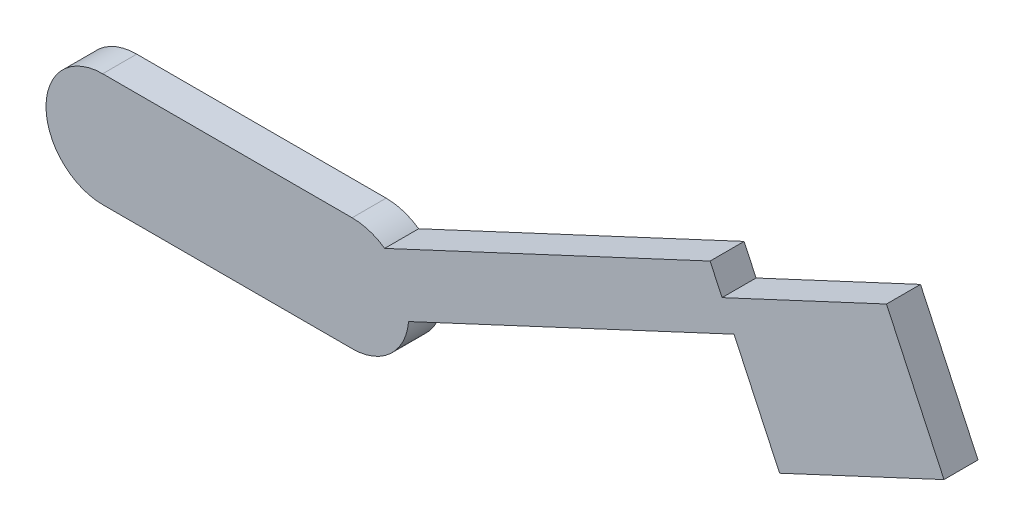
from build123d import *

# Parameters (mm, degrees)
SKETCH1_R           = 5
BOSS_EXTRUDE1_DEPTH = 3
SKETCH2_W           = 22
SKETCH2_H           = 10
BOSS_EXTRUDE2_DEPTH = 3
SKETCH3_R           = 5
BOSS_EXTRUDE3_DEPTH = 3
BOSS_EXTRUDE4_DEPTH = 3
BOSS_EXTRUDE5_DEPTH = 3


with BuildPart() as part:
    # Sketch1 → Boss-Extrude1 (new body)
    with BuildSketch(Plane.XY):
        Circle(SKETCH1_R)
    extrude(amount=BOSS_EXTRUDE1_DEPTH)

    # Sketch2 → Boss-Extrude2 (add)
    with BuildSketch(Plane.XY):
        with Locations((11, 0)):
            Rectangle(SKETCH2_W, SKETCH2_H)
    extrude(amount=BOSS_EXTRUDE2_DEPTH)

    # Sketch3 → Boss-Extrude3 (add)
    with BuildSketch(Plane.XY):
        with Locations((22, 0)):
            Circle(SKETCH3_R)
    extrude(amount=BOSS_EXTRUDE3_DEPTH)

    # Sketch4 → Boss-Extrude4 (add)
    with BuildSketch(Plane.XY):
        Polygon((20.943454346, 2.265769468), (53.570534679, 17.48002689), (55.683625988, 12.948487955), (23.056545654, -2.265769468), align=None)
    extrude(amount=BOSS_EXTRUDE4_DEPTH)

    # Sketch5 → Boss-Extrude5 (add)
    with BuildSketch(Plane.XY):
        Polygon((54.627080333, 15.214257423), (69.128004926, 21.976149611), (74.199424067, 11.100456166), (59.698499474, 4.338563978), align=None)
    extrude(amount=BOSS_EXTRUDE5_DEPTH)


solid = part.part
